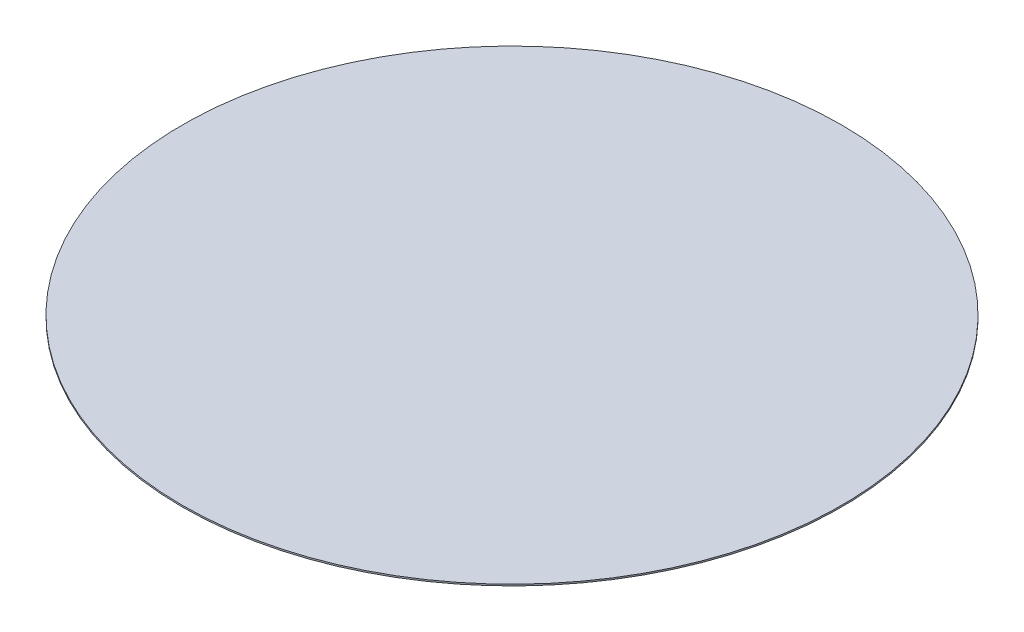
from build123d import *

# Parameters (mm, degrees)
SKETCH1_R           = 550.164
BOSS_EXTRUDE1_DEPTH = 2.54


with BuildPart() as part:
    # Sketch1 → Boss-Extrude1 (new body)
    with BuildSketch(Plane(origin=(0, 0, 0), x_dir=(1, 0, 0), z_dir=(0, 1, 0))):
        with Locations(Location((0, 0, 0), (0, 0, 270))):
            Circle(SKETCH1_R)
    extrude(amount=BOSS_EXTRUDE1_DEPTH)


solid = part.part
